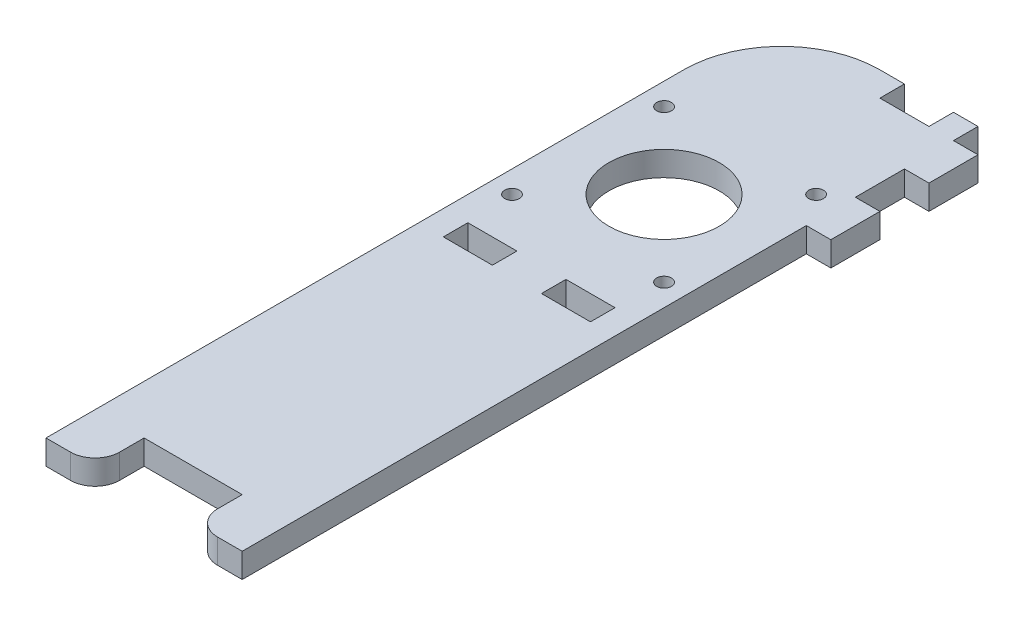
from build123d import *

# Parameters (mm, degrees)
SKETCH_1_R      = 11.25
SKETCH_1_R_2    = 1.5
SKETCH_1_W      = 10
SKETCH_1_H      = 5
EXTRUDE_2_DEPTH = 5


with BuildPart() as part:
    # 草图1 → 凸台-拉伸2 (new body)
    with BuildSketch(Plane(origin=(0, 0, 0), x_dir=(1, 0, 0), z_dir=(0, 1, 0))):
        with BuildLine():
            Line((10, 5), (10, 10))
            Line((10, 10), (30, 10))
            Line((30, 10), (30, 5))
            ThreePointArc((30, 5), (31.464466094, 1.464466094), (35, 0))
            Line((35, 0), (40, 0))
            Line((40, 0), (40, 115))
            Line((40, 115), (45, 115))
            Line((45, 115), (45, 125))
            Line((45, 125), (40, 125))
            Line((40, 125), (40, 135))
            Line((40, 135), (45, 135))
            Line((45, 135), (45, 145))
            Line((45, 145), (40, 145))
            Line((40, 145), (40, 150))
            Line((40, 150), (35, 150))
            Line((35, 150), (35, 145))
            Line((35, 145), (25, 145))
            Line((25, 145), (25, 150))
            Line((25, 150), (20, 150))
            ThreePointArc((20, 150), (5.857864376, 144.142135624), (0, 130))
            Line((0, 130), (0, 0))
            Line((0, 0), (5, 0))
            ThreePointArc((5, 0), (8.535533906, 1.464466094), (10, 5))
        make_face()
        with Locations(Location((20, 106, 0), (0, 0, 270))):
            Circle(SKETCH_1_R, mode=Mode.SUBTRACT)
        with Locations(Location((4.5, 121.5, 0), (0, 0, 270))):
            Circle(SKETCH_1_R_2, mode=Mode.SUBTRACT)
        with Locations(Location((35.5, 121.5, 0), (0, 0, 270))):
            Circle(SKETCH_1_R_2, mode=Mode.SUBTRACT)
        with Locations(Location((4.5, 90.5, 0), (0, 0, 270))):
            Circle(SKETCH_1_R_2, mode=Mode.SUBTRACT)
        with Locations(Location((35.5, 90.5, 0), (0, 0, 270))):
            Circle(SKETCH_1_R_2, mode=Mode.SUBTRACT)
        with Locations((10, 78.5)):
            Rectangle(SKETCH_1_W, SKETCH_1_H, mode=Mode.SUBTRACT)
        with Locations((30, 78.5)):
            Rectangle(SKETCH_1_W, SKETCH_1_H, mode=Mode.SUBTRACT)
    extrude(amount=EXTRUDE_2_DEPTH)


solid = part.part
